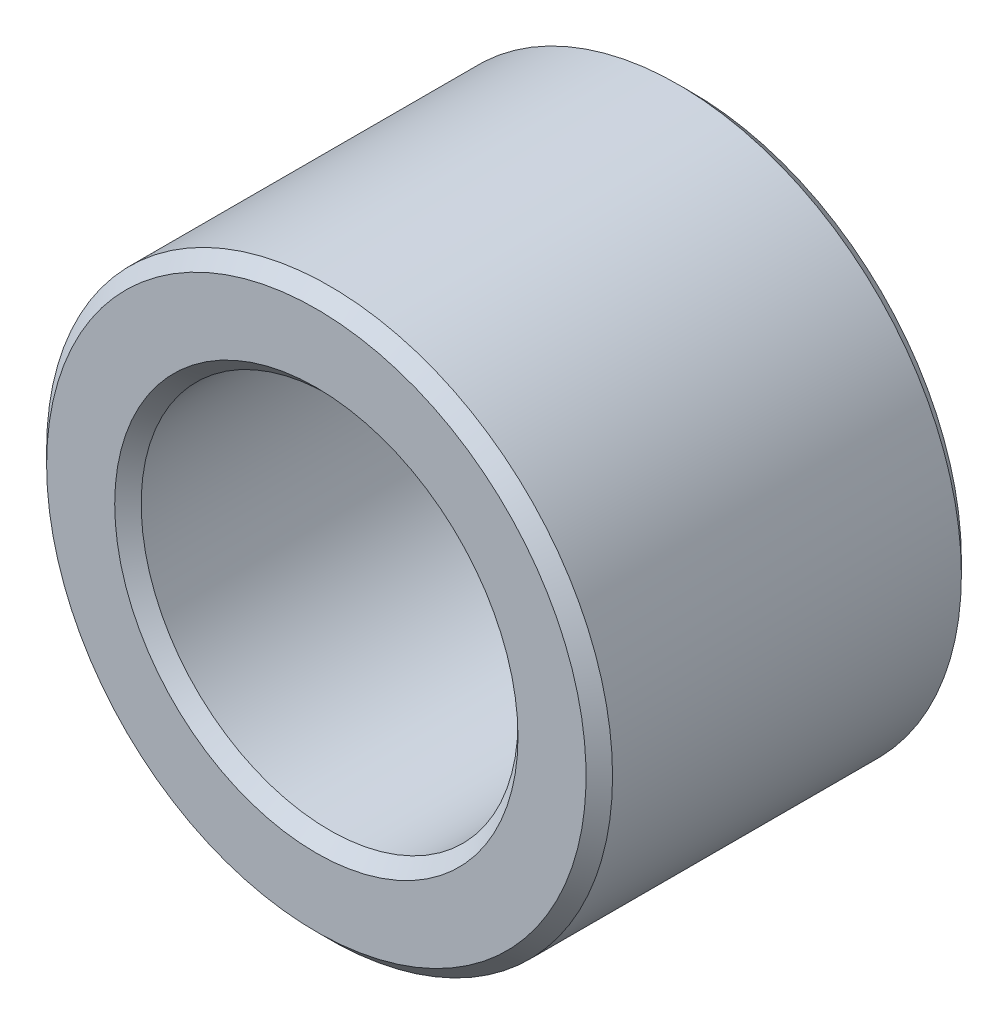
from build123d import *

# Parameters (mm, degrees)
BOSS_EXTRUDE1_DEPTH      = 3.175
BOSS_EXTRUDE1_DEPTH_BACK = 3.175
SKETCH14_R               = 4.7879
SKETCH14_R_2             = 3.1877
CHAMFER1_SIZE            = 0.224028


with BuildPart() as part:
    # Sketch14 → Boss-Extrude1 (new, two sides: drawn at the far end of the back side and taken through both)
    with BuildSketch(Plane.XY.offset(-BOSS_EXTRUDE1_DEPTH_BACK)):
        Circle(SKETCH14_R)
        Circle(SKETCH14_R_2, mode=Mode.SUBTRACT)
    extrude(amount=BOSS_EXTRUDE1_DEPTH + BOSS_EXTRUDE1_DEPTH_BACK)

    # Chamfer1
    chamfer1_edges = [part.edges().sort_by_distance(p)[0] for p in [
        (-4.7879, 0, -3.175),
        (-3.1877, 0, -3.175),
        (-4.7879, 0, 3.175),
        (-3.1877, 0, 3.175),
    ]]
    chamfer(chamfer1_edges, length=CHAMFER1_SIZE)


solid = part.part
